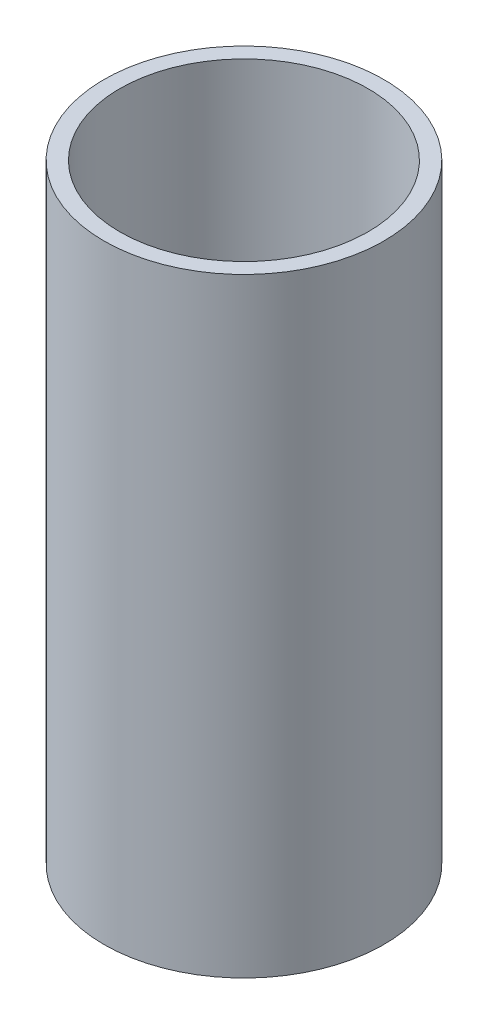
from build123d import *

# Parameters (mm, degrees)
SKETCH1_R           = 31
SKETCH1_R_2         = 27.5
BOSS_EXTRUDE1_DEPTH = 67.5


with BuildPart() as part:
    # Sketch1 → Boss-Extrude1 (new, symmetric)
    with BuildSketch(Plane(origin=(0, 0, 0), x_dir=(1, 0, 0), z_dir=(0, 1, 0))):
        with Locations(Location((0, 0, 0), (0, 0, 270))):
            Circle(SKETCH1_R)
        with Locations(Location((0, 0, 0), (0, 0, 270))):
            Circle(SKETCH1_R_2, mode=Mode.SUBTRACT)
    extrude(amount=BOSS_EXTRUDE1_DEPTH, both=True)


solid = part.part
